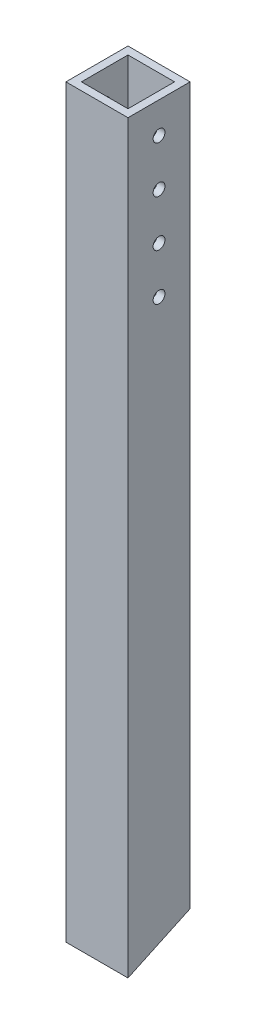
from build123d import *

# Parameters (mm, degrees)
SKETCH1_W           = 25.4
SKETCH1_H           = 25.4
SKETCH1_W_2         = 19.05
SKETCH1_H_2         = 19.05
BOSS_EXTRUDE1_DEPTH = 304.8
SKETCH2_R           = 2.413
CUT_EXTRUDE1_DEPTH  = 25.4


with BuildPart() as part:
    # Sketch1 → Boss-Extrude1 (new body)
    with BuildSketch(Plane(origin=(0, 0, 0), x_dir=(1, 0, 0), z_dir=(0, 1, 0))):
        Rectangle(SKETCH1_W, SKETCH1_H)
        Rectangle(SKETCH1_W_2, SKETCH1_H_2, mode=Mode.SUBTRACT)
    extrude(amount=BOSS_EXTRUDE1_DEPTH)

    # Sketch2 → Cut-Extrude1 (cut)
    with BuildSketch(Plane(origin=(12.7, 0, 0), x_dir=(0, 0, -1), z_dir=(1, 0, 0))):
        with Locations((0, 292.1)):
            Circle(SKETCH2_R)
        with Locations((0, 273.05)):
            Circle(SKETCH2_R)
        with Locations((0, 254)):
            Circle(SKETCH2_R)
        with Locations((0, 234.95)):
            Circle(SKETCH2_R)
        Polygon((-12.7, 0), (12.7, 11.844214517), (12.7, 0), align=None)
    extrude(amount=-CUT_EXTRUDE1_DEPTH, mode=Mode.SUBTRACT)


solid = part.part
